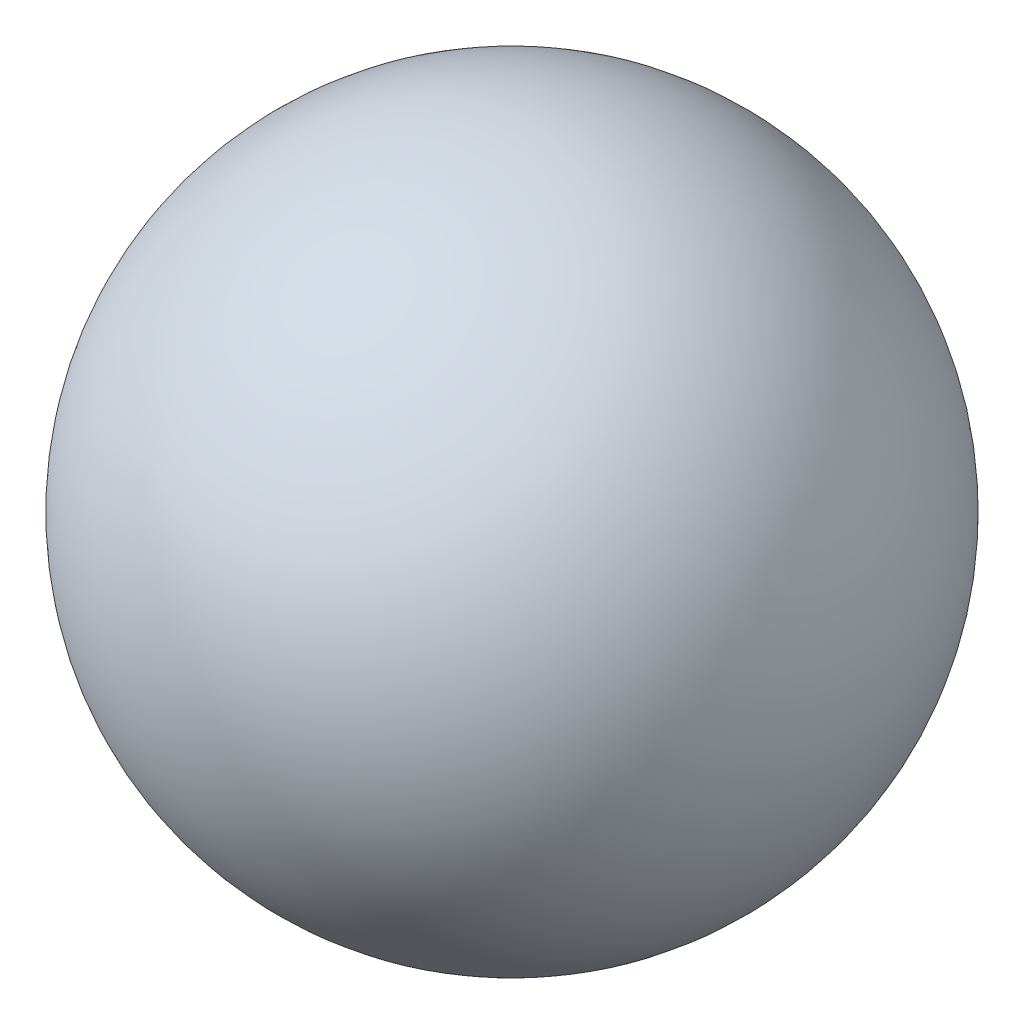
from build123d import *


with BuildPart() as part:
    # Sketch1 → Revolve1 (revolve)
    with BuildSketch(Plane.XY):
        with BuildLine():
            Line((0, -8), (0, 8))
            ThreePointArc((0, 8), (8, 0), (0, -8))
        make_face()
    revolve(axis=Axis((0, -8, 0), (0, 1, 0)))


solid = part.part
